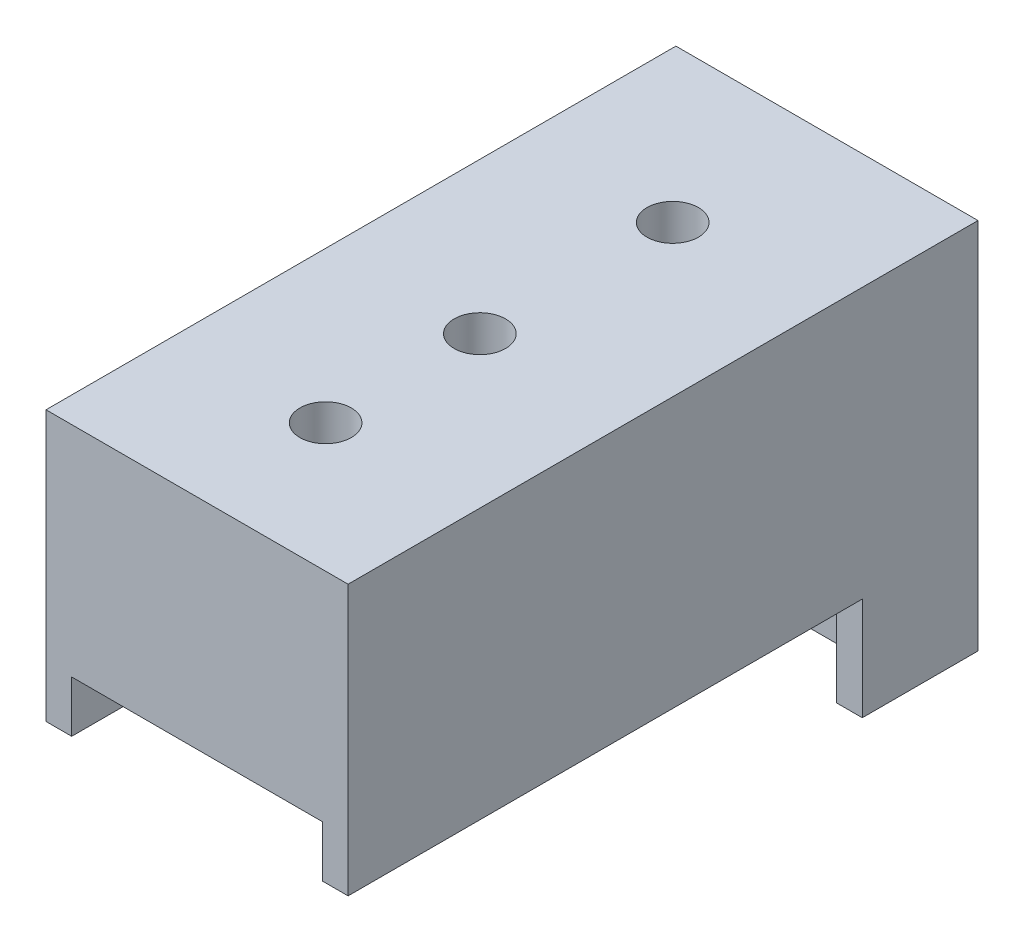
from build123d import *

# Parameters (mm, degrees)
BOSS_EXTRUDE1_DEPTH = 9.75
BOSS_EXTRUDE2_DEPTH = 2
SKETCH4_R           = 2
CUT_EXTRUDE1_DEPTH  = 49.611341269
SKETCH5_R           = 1.75
CUT_EXTRUDE2_DEPTH  = 49.611341269


with BuildPart() as part:
    # Sketch2 → Boss-Extrude1 (new, symmetric)
    with BuildSketch(Plane(origin=(0, 0, 0), x_dir=(0, 0, -1), z_dir=(1, 0, 0))):
        Polygon((-44, 0), (0, 0), (0, -12), (5, -12), (5, 17), (-44, 17), align=None)
    extrude(amount=BOSS_EXTRUDE1_DEPTH, both=True)

    # Sketch3 → Boss-Extrude2 (add)
    with BuildSketch(Plane(origin=(9.75, 0, 0), x_dir=(0, 0, -1), z_dir=(1, 0, 0))):
        Polygon((-44, 17), (-44, -4), (-4, -4), (-4, -12), (5, -12), (5, 17), align=None)
    boss_extrude2 = extrude(amount=BOSS_EXTRUDE2_DEPTH)

    # Mirror1: Boss-Extrude2 across plane
    add(boss_extrude2.mirror(Plane(origin=(0, 0, 0), x_dir=(0, 0, 1), z_dir=(1, 0, 0))))

    # Sketch4 → Cut-Extrude1 (cut, through all)
    with BuildSketch(Plane.XZ):
        with Locations(Location((0, 34, 0), (0, 0, 270))):
            Circle(SKETCH4_R)
        with Locations(Location((0, 22, 0), (0, 0, 270))):
            Circle(SKETCH4_R)
        with Locations(Location((0, 7, 0), (0, 0, 270))):
            Circle(SKETCH4_R)
    extrude(amount=-CUT_EXTRUDE1_DEPTH, mode=Mode.SUBTRACT)

    # Sketch5 → Cut-Extrude2 (cut, through all)
    with BuildSketch(Plane.XY):
        with Locations((0, -7)):
            Circle(SKETCH5_R)
    extrude(amount=-CUT_EXTRUDE2_DEPTH, mode=Mode.SUBTRACT)


solid = part.part
